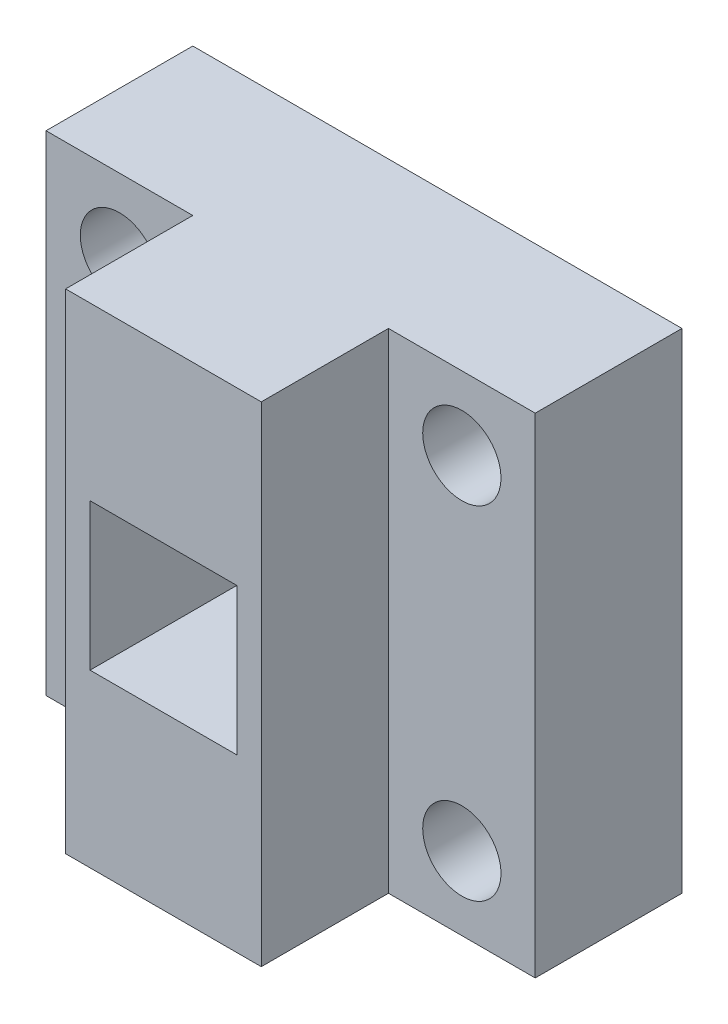
from build123d import *

# Parameters (mm, degrees)
SKETCH_1_W               = 50
SKETCH_1_H               = 50
EXTRUDE_1_DEPTH          = 15
SKETCH_2_W               = 20
SKETCH_2_H               = 50
EXTRUDE_2_DEPTH          = 13
SKETCH_3_W               = 15
SKETCH_3_H               = 15
CUT_EXTRUDE_1_DEPTH      = 46.099889135
SKETCH_5_R               = 4
CUT_EXTRUDE_3_DEPTH      = 46.099889135
MIRROR_2_COPY_1_SKETCH_R = 4
MIRROR_2_COPY_1_DEPTH    = 46.099889135


with BuildPart() as part:
    # Эскиз1 → Бобышка-Вытянуть1 (new body)
    with BuildSketch(Plane.XY):
        Rectangle(SKETCH_1_W, SKETCH_1_H)
    extrude(amount=EXTRUDE_1_DEPTH)

    # Эскиз2 → Бобышка-Вытянуть2 (add)
    with BuildSketch(Plane.XY.offset(15)):
        Rectangle(SKETCH_2_W, SKETCH_2_H)
    extrude(amount=EXTRUDE_2_DEPTH)

    # Эскиз3 → Вырез-Вытянуть1 (cut, through all)
    with BuildSketch(Plane.XY.offset(28)):
        Rectangle(SKETCH_3_W, SKETCH_3_H)
    extrude(amount=-CUT_EXTRUDE_1_DEPTH, mode=Mode.SUBTRACT)

    # Эскиз5 → Вырез-Вытянуть3 (cut, through all)
    with BuildSketch(Plane(origin=(0, 0, 0), x_dir=(-1, 0, 0), z_dir=(0, 0, -1))):
        with Locations((-17.5, -17.5)):
            Circle(SKETCH_5_R)
    cut_extrude_3 = extrude(amount=-CUT_EXTRUDE_3_DEPTH, mode=Mode.SUBTRACT)

    # Зеркальное отражение1: Вырез-Вытянуть3 across plane
    add(cut_extrude_3.mirror(Plane.ZX), mode=Mode.SUBTRACT)

    # Зеркальное отражение2: Вырез-Вытянуть3 across plane
    add(cut_extrude_3.mirror(Plane(origin=(0, 0, 0), x_dir=(0, 0, 1), z_dir=(1, 0, 0))), mode=Mode.SUBTRACT)

    # Зеркальное отражение2 copy 1 sketch → Зеркальное отражение2 copy 1 (cut, through all)
    with BuildSketch(Plane(origin=(0, 0, 0), x_dir=(1, 0, 0), z_dir=(0, 0, -1))):
        with Locations((-17.5, -17.5)):
            Circle(MIRROR_2_COPY_1_SKETCH_R)
    extrude(amount=-MIRROR_2_COPY_1_DEPTH, mode=Mode.SUBTRACT)


solid = part.part
